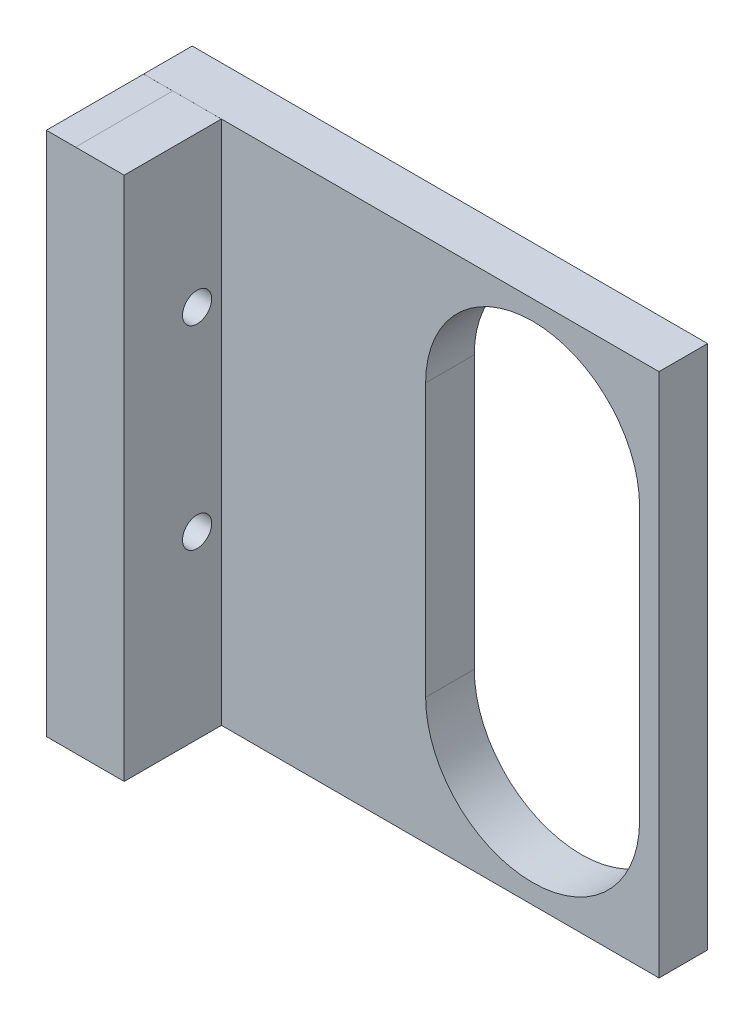
from build123d import *

# Parameters (mm, degrees)
EXTRUDE_1_DEPTH      = 5
CUT_EXTRUDE_11_DEPTH = 5
EXTRUDE_2_DEPTH      = 10
CUT_EXTRUDE_12_REACH = 82.171
SKETCH_5_R           = 1.5
EXTRUDE_3_DEPTH      = 5
SKETCH_7_R           = 1.5
CUT_EXTRUDE_13_DEPTH = 5


with BuildPart() as part:
    # 草图2 → 凸台-拉伸1 (new body)
    with BuildSketch(Plane.XY):
        Polygon((12.999999835, 4.25), (-40.000000165, 4.25), (-40.003932239, 58.249999857), (12.996067761, 58.249999857), align=None)
    extrude(amount=EXTRUDE_1_DEPTH)

    # 草图3 → 切除-拉伸11 (cut)
    with BuildSketch(Plane.XY):
        with BuildLine():
            Line((-11, 17.25), (-11, 45.25))
            ThreePointArc((-11, 45.25), (0, 56.25), (11, 45.25))
            Line((11, 45.25), (11, 17.25))
            ThreePointArc((11, 17.25), (0, 6.25), (-11, 17.25))
        make_face()
    extrude(amount=CUT_EXTRUDE_11_DEPTH, mode=Mode.SUBTRACT)

    # 草图4 → 凸台-拉伸2 (add)
    with BuildSketch(Plane.XY.offset(5)):
        Polygon((-40.000000165, 4.25), (-37.000000165, 4.25), (-37.003932052, 58.247432028), (-40.003932052, 58.247432028), align=None)
    extrude(amount=EXTRUDE_2_DEPTH)

    # 草图5 → 切除-拉伸12 (cut, up to next)
    with BuildSketch(Plane(origin=(-39.999690484, -0.002912625, 0), x_dir=(0, 0, 1), z_dir=(-0.9999999973489005, -7.281619930679468e-05, 0)), mode=Mode.PRIVATE) as cut_extrude_12_sk1:
        with Locations(Location((7.5, 42.750344808, 0), (0, 0, 270))):
            Circle(SKETCH_5_R)
    cut_extrude_12_tool1 = extrude(cut_extrude_12_sk1.sketch, amount=-CUT_EXTRUDE_12_REACH, mode=Mode.PRIVATE) & part.part
    # 草图5 → 切除-拉伸12 (cut, up to next)
    with BuildSketch(Plane(origin=(-39.999690484, -0.002912625, 0), x_dir=(0, 0, 1), z_dir=(-0.9999999973489005, -7.281619930679468e-05, 0)), mode=Mode.PRIVATE) as cut_extrude_12_sk2:
        with Locations(Location((7.5, 22.750344808, 0), (0, 0, 270))):
            Circle(SKETCH_5_R)
    cut_extrude_12_tool2 = extrude(cut_extrude_12_sk2.sketch, amount=-CUT_EXTRUDE_12_REACH, mode=Mode.PRIVATE) & part.part
    add(cut_extrude_12_tool1.solids().sort_by_distance((-40.002803, 42.747432, 7.5))[0], mode=Mode.SUBTRACT)
    add(cut_extrude_12_tool2.solids().sort_by_distance((-40.001347, 22.747432, 7.5))[0], mode=Mode.SUBTRACT)

    # 草图6 → 凸台-拉伸3 (add)
    with BuildSketch(Plane(origin=(-36.9996905, -0.002694177, 0), x_dir=(0, 0, -1), z_dir=(0.9999999973489007, 7.281619931373636e-05, 0))):
        Polygon((-15, 58.25012636), (-5, 58.25012636), (-5, 4.249053378), (-15, 4.252694188), align=None)
    extrude(amount=EXTRUDE_3_DEPTH)

    # 草图7 → 切除-拉伸13 (cut)
    with BuildSketch(Plane(origin=(-31.999690513, -0.002330096, 0), x_dir=(0, 0, -1), z_dir=(0.9999999973489007, 7.281619931373636e-05, 0))):
        with Locations(Location((-7.5, 42.75012636, 0), (0, 0, 90))):
            Circle(SKETCH_7_R)
        with Locations(Location((-7.5, 22.75012636, 0), (0, 0, 90))):
            Circle(SKETCH_7_R)
    extrude(amount=-CUT_EXTRUDE_13_DEPTH, mode=Mode.SUBTRACT)


solid = part.part
